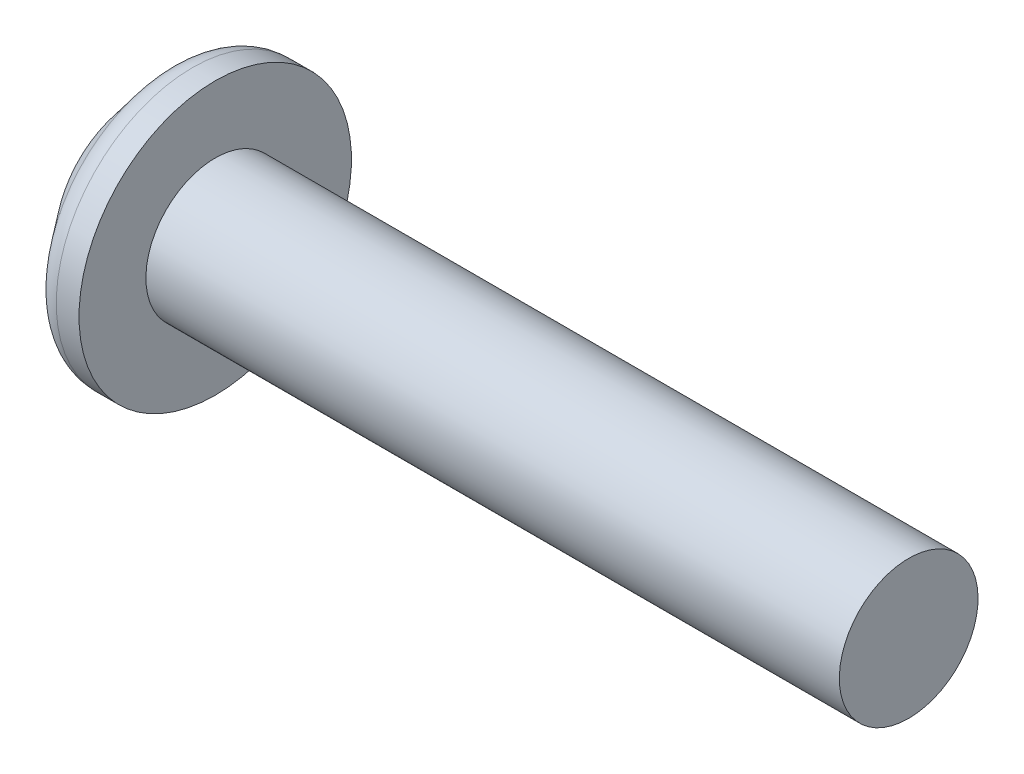
from build123d import *

# Parameters (mm, degrees)
CUT_EXTRUDE1_DEPTH = 1.5
FILLET1_R          = 0.5


with BuildPart() as part:
    # Sketch1 → Revolve1 (revolve)
    with BuildSketch(Plane.XY, mode=Mode.PRIVATE) as revolve1_sk:
        Polygon((15.7, 0), (15.7, 1.4), (1.7, 1.4), (1.7, 2.75), (1, 2.75), (0, 1.5), (0, 0), align=None)
    revolve(revolve1_sk.sketch.rotate(Axis((0, 0, 0), (1, 0, 0)), 180), axis=Axis((0, 0, 0), (1, 0, 0)))

    # Sketch2 → Cut-Extrude1 (cut)
    with BuildSketch(Plane.ZY):
        Polygon((1.154700538, 0), (0.577350269, 1), (-0.577350269, 1), (-1.154700538, 0), (-0.577350269, -1), (0.577350269, -1), align=None)
    extrude(amount=-CUT_EXTRUDE1_DEPTH, mode=Mode.SUBTRACT)

    # Fillet1
    fillet1_edges = [part.edges().sort_by_distance(p)[0] for p in [
        (1, 2.75, 0),
        (0, 1.5, 0),
    ]]
    fillet(fillet1_edges, radius=FILLET1_R)


solid = part.part
